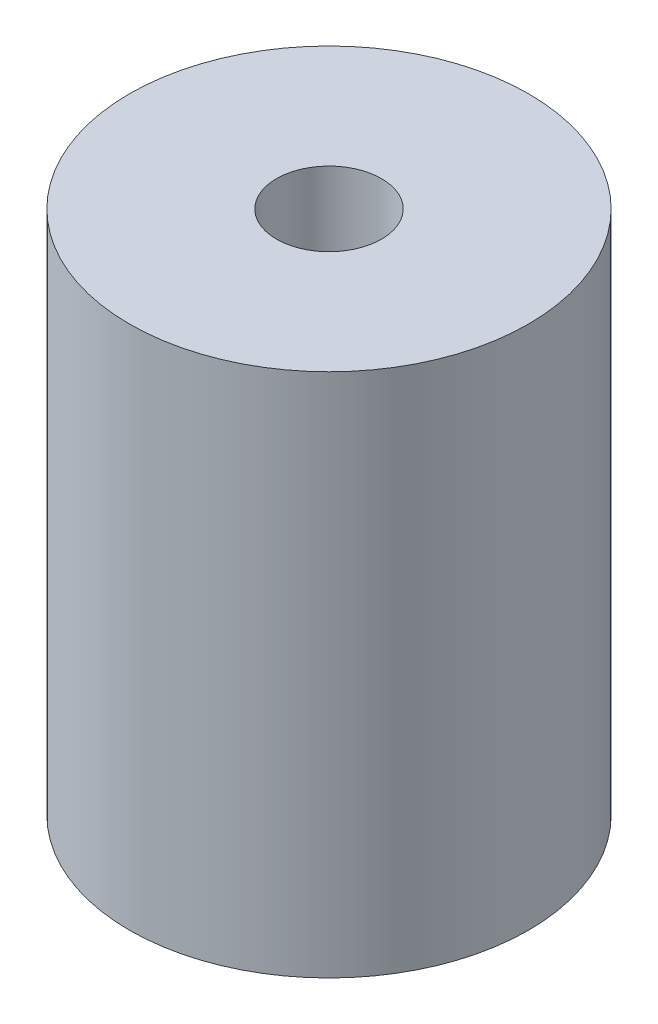
from build123d import *

# Parameters (mm, degrees)
ESBO_O1_R                = 9.5
RESSALTO_EXTRUS_O1_DEPTH = 25
ESBO_O2_R                = 2.5
CORTE_EXTRUS_O1_DEPTH    = 13
ESBO_O3_R                = 4
CORTE_EXTRUS_O2_DEPTH    = 13


with BuildPart() as part:
    # Esboço1 → Ressalto-extrusão1 (new body)
    with BuildSketch(Plane(origin=(0, 0, 0), x_dir=(1, 0, 0), z_dir=(0, 1, 0))):
        with Locations(Location((0, 0, 0), (0, 0, 270))):
            Circle(ESBO_O1_R)
    extrude(amount=RESSALTO_EXTRUS_O1_DEPTH)

    # Esboço2 → Corte-extrusão1 (cut)
    with BuildSketch(Plane(origin=(0, 25, 0), x_dir=(1, 0, 0), z_dir=(0, 1, 0))):
        with Locations(Location((0, 0, 0), (0, 0, 270))):
            Circle(ESBO_O2_R)
    extrude(amount=-CORTE_EXTRUS_O1_DEPTH, mode=Mode.SUBTRACT)

    # Esboço3 → Corte-extrusão2 (cut)
    with BuildSketch(Plane.XZ):
        with Locations(Location((0, 0, 0), (0, 0, 270))):
            Circle(ESBO_O3_R)
    extrude(amount=-CORTE_EXTRUS_O2_DEPTH, mode=Mode.SUBTRACT)


solid = part.part
